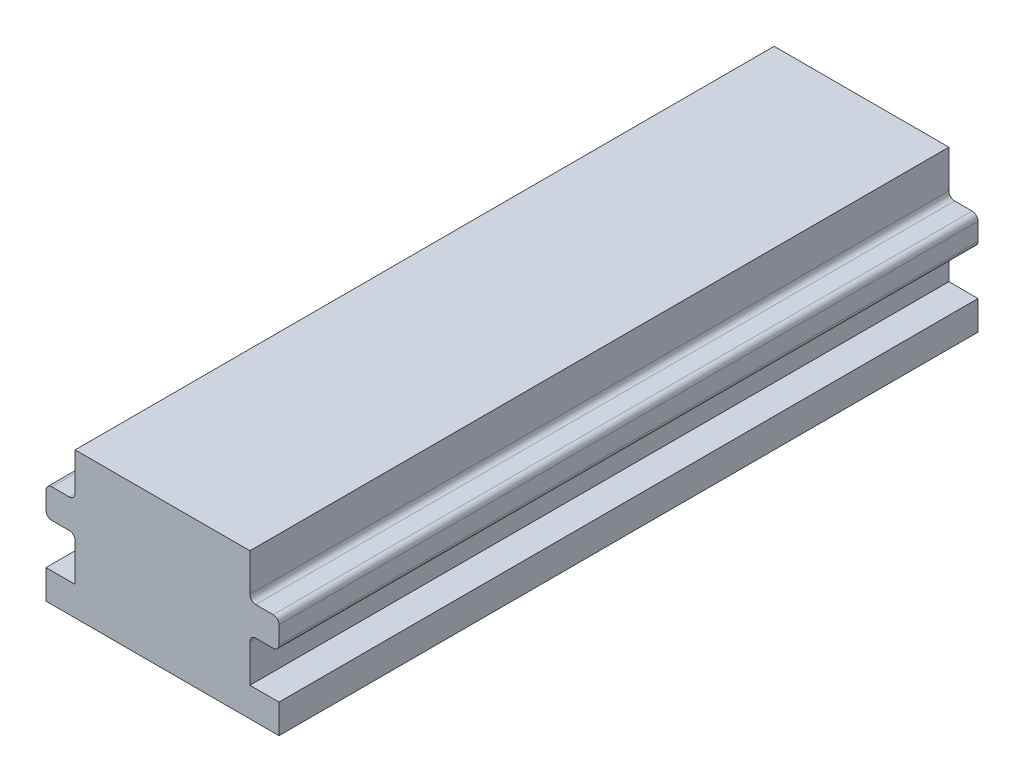
from build123d import *

# Parameters (mm, degrees)
SKETCH1_W          = 50.8
SKETCH1_H          = 31.75
BASE_EXTRUDE_DEPTH = 152.4
CUT_EXTRUDE1_DEPTH = 152.4


with BuildPart() as part:
    # Sketch1 → Base-Extrude (new body)
    with BuildSketch(Plane.XY):
        with Locations((25.4, 15.875)):
            Rectangle(SKETCH1_W, SKETCH1_H)
    extrude(amount=BASE_EXTRUDE_DEPTH)

    # Sketch2 → Cut-Extrude1 (cut)
    with BuildSketch(Plane.XY.offset(152.4)):
        with BuildLine():
            Line((50.8, 6.35), (44.45, 6.35))
            Line((44.45, 6.35), (44.45, 14.605))
            ThreePointArc((44.45, 14.605), (44.821974388, 15.503025612), (45.72, 15.875))
            Line((45.72, 15.875), (49.53, 15.875))
            ThreePointArc((49.53, 15.875), (50.428025612, 16.246974388), (50.8, 17.145))
            Line((50.8, 17.145), (50.8, 20.955))
            ThreePointArc((50.8, 20.955), (50.428025612, 21.853025612), (49.53, 22.225))
            Line((49.53, 22.225), (45.72, 22.225))
            ThreePointArc((45.72, 22.225), (44.821974388, 22.596974388), (44.45, 23.495))
            Line((44.45, 23.495), (44.45, 36.83))
            Line((44.45, 36.83), (54.61, 36.83))
            Line((54.61, 36.83), (54.61, 6.35))
            Line((54.61, 6.35), (50.8, 6.35))
        make_face()
        with BuildLine():
            Line((6.35, 38.1), (6.35, 23.495))
            ThreePointArc((6.35, 23.495), (5.978025612, 22.596974388), (5.08, 22.225))
            Line((5.08, 22.225), (1.27, 22.225))
            ThreePointArc((1.27, 22.225), (0.371974388, 21.853025612), (0, 20.955))
            Line((0, 20.955), (0, 17.145))
            ThreePointArc((0, 17.145), (0.371974388, 16.246974388), (1.27, 15.875))
            Line((1.27, 15.875), (5.08, 15.875))
            ThreePointArc((5.08, 15.875), (5.978025612, 15.503025612), (6.35, 14.605))
            Line((6.35, 14.605), (6.35, 6.35))
            Line((6.35, 6.35), (0, 6.35))
            Line((0, 6.35), (-3.81, 6.35))
            Line((-3.81, 6.35), (-3.81, 38.1))
            Line((-3.81, 38.1), (6.35, 38.1))
        make_face()
    extrude(amount=-CUT_EXTRUDE1_DEPTH, mode=Mode.SUBTRACT)


solid = part.part
